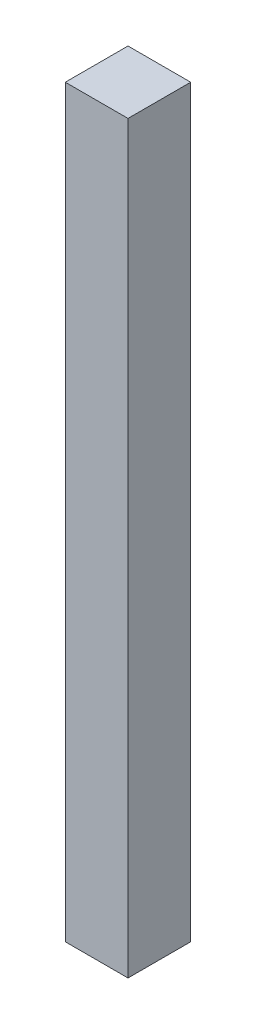
from build123d import *

# Parameters (mm, degrees)
ESQUISSE1_W        = 20.3
ESQUISSE1_H        = 20.3
BOSS_EXTRU_1_DEPTH = 241


with BuildPart() as part:
    # Esquisse1 → Boss.-Extru.1 (new body)
    with BuildSketch(Plane(origin=(0, 0, 0), x_dir=(1, 0, 0), z_dir=(0, 1, 0))):
        with Locations((10.15, 10.15)):
            Rectangle(ESQUISSE1_W, ESQUISSE1_H)
    extrude(amount=BOSS_EXTRU_1_DEPTH)


solid = part.part
